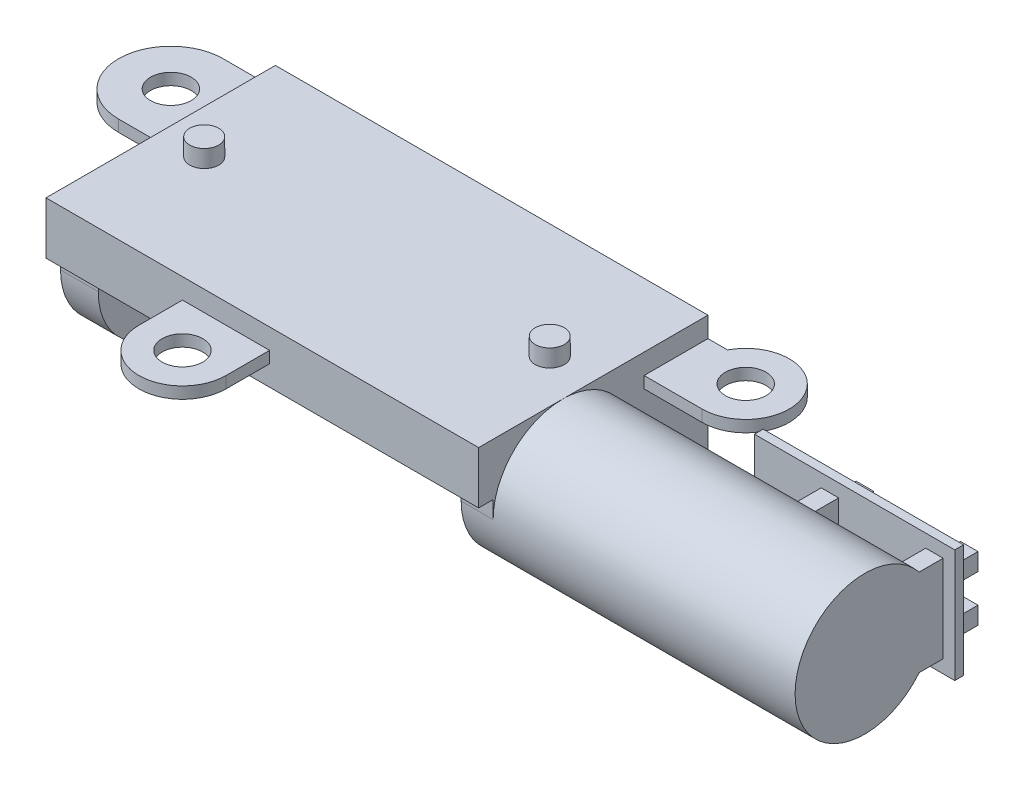
from build123d import *

# Parameters (mm, degrees)
SKETCH_1_R          = 2.4
EXTRUDE_1_DEPTH     = 11.5
SKETCH_1_7_W        = 0.5
SKETCH_1_7_H        = 1.8
EXTRUDE_3_DEPTH     = 1.1
EXTRUDE_START       = -13.8
SKETCH_1_8_W        = 0.5
SKETCH_1_8_H        = 1.8
EXTRUDE_4_DEPTH     = 14.9
EXTRUDE_5_DEPTH     = 1.3
SKETCH_3_W          = 0.6
SKETCH_3_H          = 0.6
EXTRUDE_6_DEPTH     = 3.9
SKETCH_3_3_W        = 0.6
SKETCH_3_3_H        = 3
EXTRUDE_7_DEPTH     = 3
EXTRUDE_START_2     = -3
SKETCH_4_W          = 6.9
SKETCH_4_H          = 3.9
EXTRUDE_8_DEPTH     = 0.3
SKETCH_6_W          = 12.5
SKETCH_6_H          = 7.5
CUT_EXTRUDE_1_DEPTH = 0.7
EXTRUDE_START_3     = -1.3
SKETCH_5_R          = 0.7
EXTRUDE_9_DEPTH     = 0.4
SKETCH_7_R          = 0.9
SKETCH_7_R_2        = 0.8
EXTRUDE_10_DEPTH    = 12.5
SKETCH_8_R          = 0.5
EXTRUDE_11_DEPTH    = 0.6
SKETCH_9_W          = 55.778584291
SKETCH_9_H          = 36.536448335
CUT_EXTRUDE_2_DEPTH = 23.165964901


with BuildPart() as part:
    # 草图1 → 凸台-拉伸1 (new body)
    with BuildSketch(Plane(origin=(0, 0, 0), x_dir=(0, 0, -1), z_dir=(1, 0, 0))):
        Circle(SKETCH_1_R)
    extrude(amount=EXTRUDE_1_DEPTH)

    # 草图1<7> → 凸台-拉伸3 (add)
    with BuildSketch(Plane(origin=(0, 0, 0), x_dir=(0, 0, -1), z_dir=(1, 0, 0))):
        with BuildLine():
            Line((5, -0.6), (2.323790008, -0.6))
            ThreePointArc((2.323790008, -0.6), (1.469693849, -1.897366594), (8e-09, -2.4))
            Line((8e-09, -2.4), (5, -2.4))
            Line((5, -2.4), (5, -0.6))
        make_face()
        with BuildLine():
            Line((-2.323790008, -0.6), (-2.4, -0.6))
            Line((-2.4, -0.6), (-2.4, -2.4))
            Line((-2.4, -2.4), (8e-09, -2.4))
            ThreePointArc((8e-09, -2.4), (-1.469693842, -1.897366599), (-2.323790008, -0.6))
        make_face()
        with Locations((-2.65, -1.5)):
            Rectangle(SKETCH_1_7_W, SKETCH_1_7_H)
        with BuildLine():
            Line((5, 2), (1.326649916, 2))
            ThreePointArc((1.326649916, 2), (2.114705629, 1.134909732), (2.4, 0))
            ThreePointArc((2.4, 0), (2.380871271, -0.302410302), (2.323790008, -0.6))
            Line((2.323790008, -0.6), (5, -0.6))
            Line((5, -0.6), (5, 2))
        make_face()
        with BuildLine():
            ThreePointArc((-2.323790008, -0.6), (-2.380871271, -0.302410299), (-2.4, 5e-09))
            Line((-2.4, 5e-09), (-2.4, -0.6))
            Line((-2.4, -0.6), (-2.323790008, -0.6))
        make_face()
    extrude(amount=EXTRUDE_3_DEPTH)

    # 草图1<8> → 凸台-拉伸4 (add)
    with BuildSketch(Plane(origin=(0, 0, 0), x_dir=(0, 0, -1), z_dir=(1, 0, 0)).offset(EXTRUDE_START)):
        with BuildLine():
            Line((5, -0.6), (2.323790008, -0.6))
            ThreePointArc((2.323790008, -0.6), (1.469693849, -1.897366594), (8e-09, -2.4))
            Line((8e-09, -2.4), (5, -2.4))
            Line((5, -2.4), (5, -0.6))
        make_face()
        with BuildLine():
            Line((2.323790008, -0.6), (-2.323790008, -0.6))
            ThreePointArc((-2.323790008, -0.6), (-1.469693842, -1.897366599), (8e-09, -2.4))
            ThreePointArc((8e-09, -2.4), (1.469693849, -1.897366594), (2.323790008, -0.6))
        make_face()
        with BuildLine():
            Line((-2.323790008, -0.6), (-2.4, -0.6))
            Line((-2.4, -0.6), (-2.4, -2.4))
            Line((-2.4, -2.4), (8e-09, -2.4))
            ThreePointArc((8e-09, -2.4), (-1.469693842, -1.897366599), (-2.323790008, -0.6))
        make_face()
        with Locations((-2.65, -1.5)):
            Rectangle(SKETCH_1_8_W, SKETCH_1_8_H)
    extrude(amount=EXTRUDE_4_DEPTH)

    # 草图1<9> → 凸台-拉伸5 (add)
    with BuildSketch(Plane(origin=(0, 0, 0), x_dir=(0, 0, -1), z_dir=(1, 0, 0)).offset(EXTRUDE_START)):
        with BuildLine():
            Line((5, 2), (1.326649916, 2))
            ThreePointArc((1.326649916, 2), (2.114705629, 1.134909732), (2.4, 0))
            ThreePointArc((2.4, 0), (2.380871271, -0.302410302), (2.323790008, -0.6))
            Line((2.323790008, -0.6), (5, -0.6))
            Line((5, -0.6), (5, 2))
        make_face()
        with BuildLine():
            Line((1.326649916, 2), (-1.326649916, 2))
            ThreePointArc((-1.326649916, 2), (-2.114705628, 1.134909735), (-2.4, 5e-09))
            ThreePointArc((-2.4, 5e-09), (-2.380871271, -0.302410299), (-2.323790008, -0.6))
            Line((-2.323790008, -0.6), (2.323790008, -0.6))
            ThreePointArc((2.323790008, -0.6), (2.380871271, -0.302410302), (2.4, 0))
            ThreePointArc((2.4, 0), (2.114705629, 1.134909732), (1.326649916, 2))
        make_face()
        with BuildLine():
            ThreePointArc((-2.323790008, -0.6), (-2.380871271, -0.302410299), (-2.4, 5e-09))
            Line((-2.4, 5e-09), (-2.4, -0.6))
            Line((-2.4, -0.6), (-2.323790008, -0.6))
        make_face()
    extrude(amount=EXTRUDE_5_DEPTH)

    # 草图3 → 凸台-拉伸6 (add)
    with BuildSketch(Plane.XY):
        with Locations((11.2, 0.8)):
            Rectangle(SKETCH_3_W, SKETCH_3_H)
        with Locations((11.2, -0.8)):
            Rectangle(SKETCH_3_W, SKETCH_3_H)
        with Locations((7.6, 0.8)):
            Rectangle(SKETCH_3_W, SKETCH_3_H)
        with Locations((7.6, -0.8)):
            Rectangle(SKETCH_3_W, SKETCH_3_H)
    extrude(amount=-EXTRUDE_6_DEPTH)

    # 草图3<3> → 凸台-拉伸7 (add)
    with BuildSketch(Plane.XY):
        with Locations((11.2, 0)):
            Rectangle(SKETCH_3_3_W, SKETCH_3_3_H)
        with Locations((7.6, 0)):
            Rectangle(SKETCH_3_3_W, SKETCH_3_3_H)
    extrude(amount=-EXTRUDE_7_DEPTH)

    # 草图4 → 凸台-拉伸8 (add)
    with BuildSketch(Plane.XY.offset(EXTRUDE_START_2)):
        with Locations((8.45, 0)):
            Rectangle(SKETCH_4_W, SKETCH_4_H)
    extrude(amount=EXTRUDE_8_DEPTH)

    # 草图6 → 切除-拉伸1 (cut)
    with BuildSketch(Plane(origin=(0, -0.6, 0), x_dir=(1, 0, 0), z_dir=(0, 1, 0))):
        with Locations((-6.25, 1.25)):
            Rectangle(SKETCH_6_W, SKETCH_6_H)
    extrude(amount=-CUT_EXTRUDE_1_DEPTH, mode=Mode.SUBTRACT)

    # 草图5 → 凸台-拉伸9 (add)
    # profile 1 of 3: a face of its own
    with BuildSketch(Plane(origin=(0, 0, 0), x_dir=(1, 0, 0), z_dir=(0, 1, 0)).offset(EXTRUDE_START_3)):
        with BuildLine():
            ThreePointArc((3.1, 2.8), (4.384523258, 5.074596669), (1.773350084, 5))
            Line((1.773350084, 5), (1.1, 5))
            Line((1.1, 5), (1.1, 2.8))
            Line((1.1, 2.8), (3.1, 2.8))
        make_face()
        with Locations(Location((3.1, 4.3, 0), (0, 0, 270))):
            Circle(SKETCH_5_R, mode=Mode.SUBTRACT)
    # profile 2 of 3: a face of its own
    with BuildSketch(Plane(origin=(0, 0, 0), x_dir=(1, 0, 0), z_dir=(0, 1, 0)).offset(EXTRUDE_START_3)):
        with BuildLine():
            Line((-6.1, -4.4), (-6.1, -2.9))
            Line((-6.1, -2.9), (-9.1, -2.9))
            Line((-9.1, -2.9), (-9.1, -4.4))
            ThreePointArc((-9.1, -4.4), (-7.6, -5.9), (-6.1, -4.4))
        make_face()
        with Locations(Location((-7.6, -4.4, 0), (0, 0, 270))):
            Circle(SKETCH_5_R, mode=Mode.SUBTRACT)
    # profile 3 of 3: a face of its own
    with BuildSketch(Plane(origin=(0, 0, 0), x_dir=(1, 0, 0), z_dir=(0, 1, 0)).offset(EXTRUDE_START_3)):
        with BuildLine():
            Line((-13.8, 5), (-15.6, 5))
            ThreePointArc((-15.6, 5), (-17.4, 3.2), (-15.6, 1.4))
            Line((-15.6, 1.4), (-13.8, 1.4))
            Line((-13.8, 1.4), (-13.8, 5))
        make_face()
        with Locations(Location((-15.6, 3.2, 0), (0, 0, 270))):
            Circle(SKETCH_5_R, mode=Mode.SUBTRACT)
    extrude(amount=-EXTRUDE_9_DEPTH)

    # 草图7 → 凸台-拉伸10 (add)
    with BuildSketch(Plane.ZY):
        with Locations(Location((0, 0, 0), (0, 0, 180))):
            Circle(SKETCH_7_R)
        with Locations(Location((-3.3, 0, 0), (0, 0, 180))):
            Circle(SKETCH_7_R_2)
    extrude(amount=EXTRUDE_10_DEPTH)

    # 草图8 → 凸台-拉伸11 (add)
    with BuildSketch(Plane.XZ.offset(2.4)):
        with Locations(Location((-12.3, -1.05, 0), (0, 0, 90))):
            Circle(SKETCH_8_R)
        with Locations(Location((-0.4, -1.05, 0), (0, 0, 90))):
            Circle(SKETCH_8_R)
    extrude(amount=EXTRUDE_11_DEPTH)


with BuildPart() as body_2:
    # 镜向2: mirrored copy
    add(part.part.mirror(Plane.ZX.offset(-10)))


with BuildPart() as part_1:
    add(part.part)

    # 草图9 → 切除-拉伸2 (cut, through all)
    with BuildSketch(Plane(origin=(0, -10, 0), x_dir=(1, 0, 0), z_dir=(0, 1, 0))):
        with Locations((1.175159636, 0.404925991)):
            Rectangle(SKETCH_9_W, SKETCH_9_H)
    extrude(amount=CUT_EXTRUDE_2_DEPTH, mode=Mode.SUBTRACT)


solid = body_2.part
